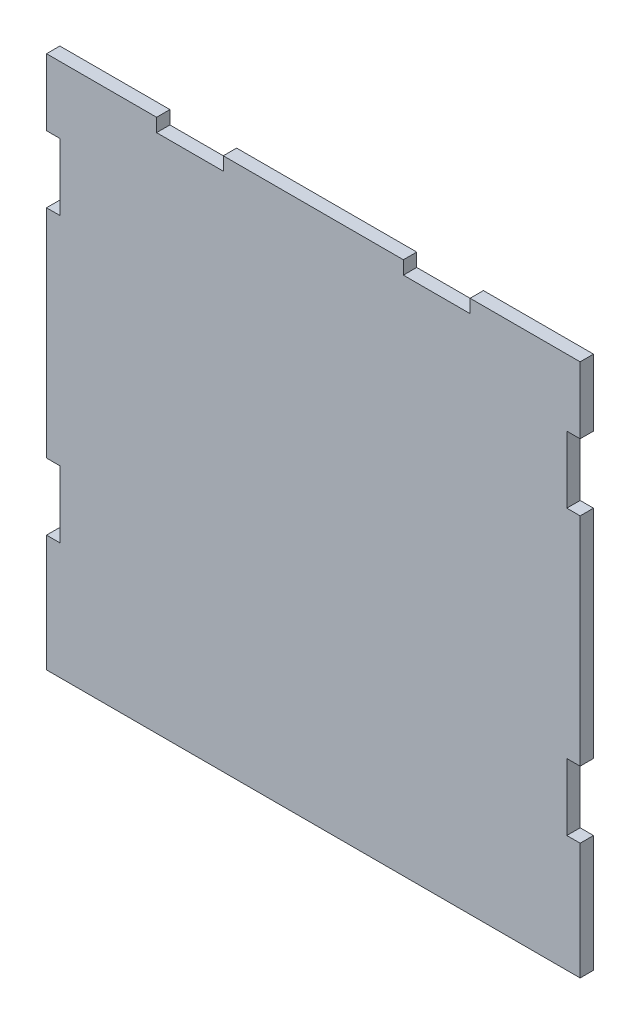
from build123d import *

# Parameters (mm, degrees)
SKETCH1_W           = 203.2
SKETCH1_H           = 101.6
BOSS_EXTRUDE1_DEPTH = 5.08
SKETCH2_W           = 5.08
SKETCH2_H           = 25.4
SKETCH2_W_2         = 25.4
SKETCH2_H_2         = 5.08
CUT_EXTRUDE1_DEPTH  = 5.08


with BuildPart() as part:
    # Sketch1 → Boss-Extrude1 (new body)
    with BuildSketch(Plane.XY):
        with Locations((0, 50.8)):
            Rectangle(SKETCH1_W, SKETCH1_H)
        with Locations((0, -50.8)):
            Rectangle(SKETCH1_W, SKETCH1_H)
    extrude(amount=BOSS_EXTRUDE1_DEPTH)

    # Sketch2 → Cut-Extrude1 (cut)
    with BuildSketch(Plane(origin=(0, 0, 0), x_dir=(-1, 0, 0), z_dir=(0, 0, -1))):
        with Locations((-99.06, -44.45)):
            Rectangle(SKETCH2_W, SKETCH2_H)
        with Locations((99.06, -44.45)):
            Rectangle(SKETCH2_W, SKETCH2_H)
        with Locations((99.06, 63.5)):
            Rectangle(SKETCH2_W, SKETCH2_H)
        with Locations((46.99, 99.06)):
            Rectangle(SKETCH2_W_2, SKETCH2_H_2)
        with Locations((-46.99, 99.06)):
            Rectangle(SKETCH2_W_2, SKETCH2_H_2)
        with Locations((-99.06, 63.5)):
            Rectangle(SKETCH2_W, SKETCH2_H)
    extrude(amount=-CUT_EXTRUDE1_DEPTH, mode=Mode.SUBTRACT)


solid = part.part
